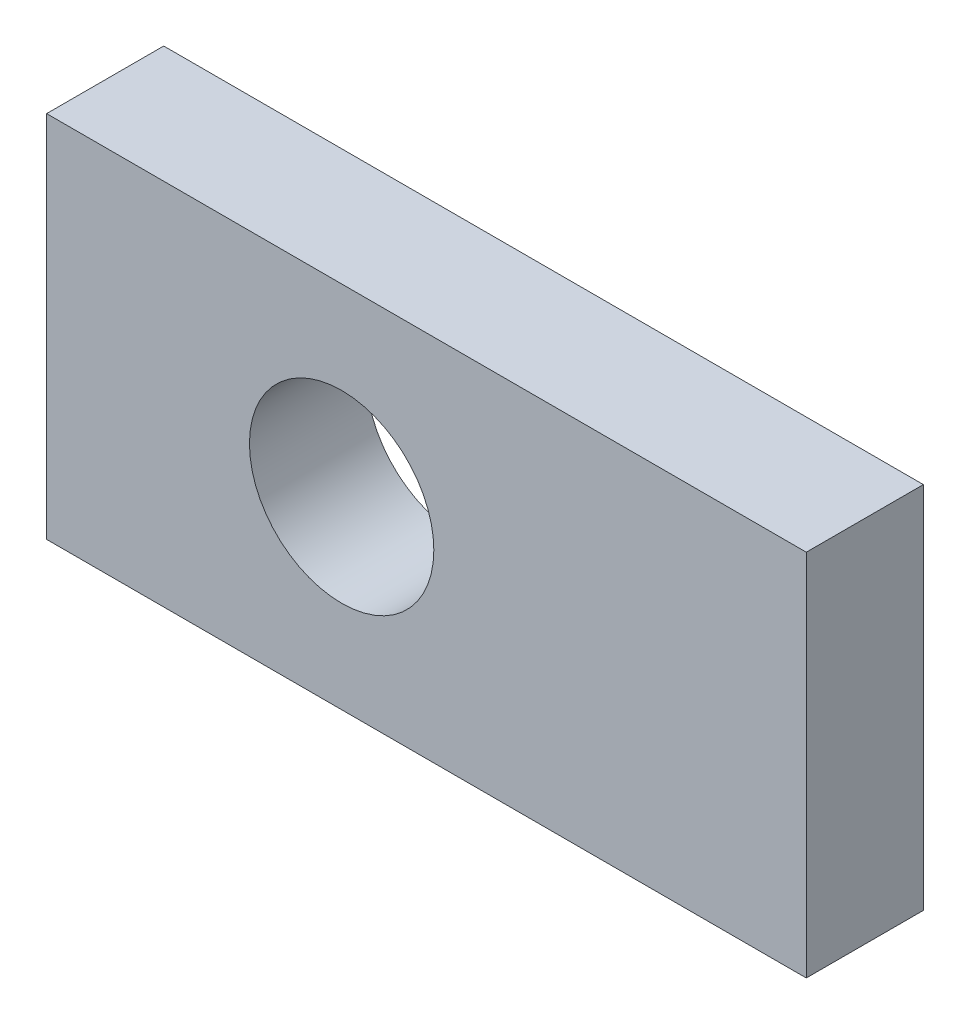
from build123d import *

# Parameters (mm, degrees)
CROQUIS1_W              = 20.6
CROQUIS1_H              = 3.175
SALIENTE_EXTRUIR1_DEPTH = 10
CROQUIS2_R              = 2.5
CORTAR_EXTRUIR1_DEPTH   = 15.702742091


with BuildPart() as part:
    # Croquis1 → Saliente-Extruir1 (new body)
    with BuildSketch(Plane(origin=(0, 0, 0), x_dir=(1, 0, 0), z_dir=(0, 1, 0))):
        Rectangle(CROQUIS1_W, CROQUIS1_H)
    extrude(amount=SALIENTE_EXTRUIR1_DEPTH)

    # Croquis2 → Cortar-Extruir1 (cut, through all)
    with BuildSketch(Plane.XY.offset(1.5875)):
        with Locations((-2.3, 5)):
            Circle(CROQUIS2_R)
    extrude(amount=-CORTAR_EXTRUIR1_DEPTH, mode=Mode.SUBTRACT)


solid = part.part
